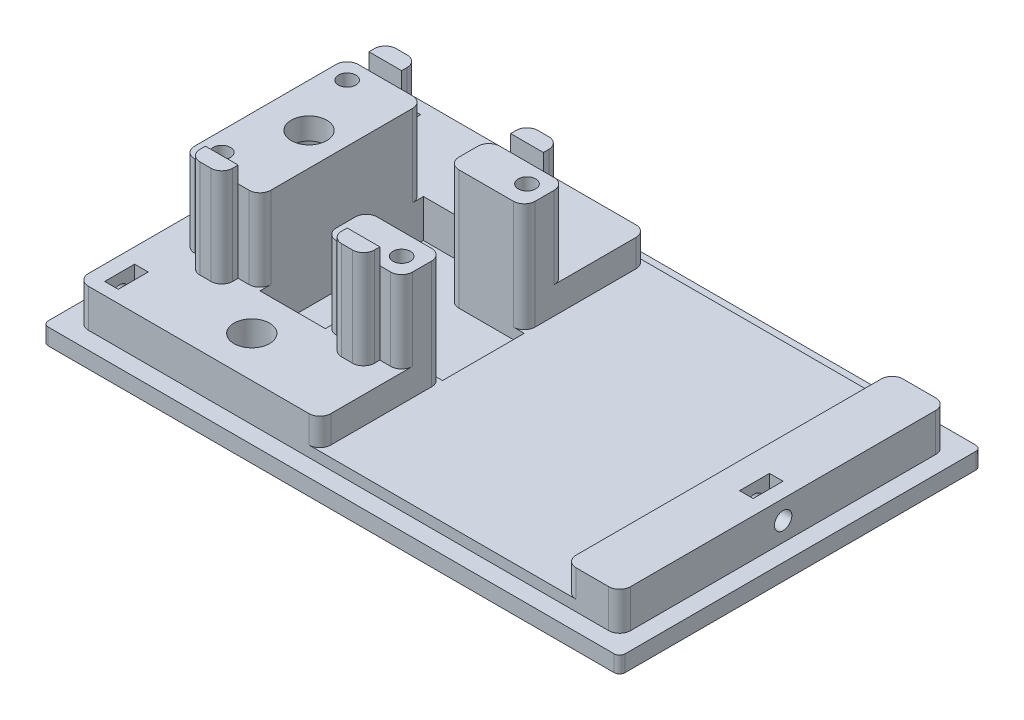
from build123d import *

# Parameters (mm, degrees)
SKETCH1_W                = 40
SKETCH1_H                = 30
BOSS_EXTRUDE1_DEPTH      = 15
SKETCH2_W                = 99.5
SKETCH2_H                = 60
BOSS_EXTRUDE2_DEPTH      = 10
M3_CLEARANCE_HOLE1_D     = 3.2
SKETCH7_W                = 105.85
SKETCH7_H                = 66.35
SKETCH7_W_2              = 99.5
SKETCH7_H_2              = 60
BOSS_EXTRUDE3_DEPTH      = 3
CUT_EXTRUDE2_DEPTH       = 1.25
M3_CLEARANCE_HOLE3_D     = 3.2
M3_CLEARANCE_HOLE3_DEPTH = 12
M3_CLEARANCE_HOLE3_TIP   = 0.96137699
F_1_4_CLEARANCE_HOLE3_D  = 6.5278
SKETCH20_R               = 2.8
SKETCH20_R_2             = 5
CUT_EXTRUDE4_DEPTH       = 21
SKETCH23_W               = 6.48
SKETCH23_H               = 3
BOSS_EXTRUDE5_DEPTH      = 10
SKETCH43_W               = 6
SKETCH43_H               = 3
BOSS_EXTRUDE7_DEPTH      = 18
F_1_4_CLEARANCE_HOLE2_D  = 6.5278
CUT_EXTRUDE9_START       = -22
CUT_EXTRUDE9_DEPTH       = 22
SKETCH45_W               = 45
SKETCH45_H               = 60
CUT_EXTRUDE10_DEPTH      = 5
CUT_EXTRUDE11_DEPTH      = 1.25
M3_CLEARANCE_HOLE5_D     = 3.2
M3_CLEARANCE_HOLE5_DEPTH = 10
M3_CLEARANCE_HOLE5_TIP   = 0.96137699
FILLET3_R                = 2
FILLET4_R                = 1


with BuildPart() as part:
    # Sketch1 → Boss-Extrude1 (new body)
    with BuildSketch(Plane(origin=(0, 0, 0), x_dir=(1, 0, 0), z_dir=(0, 1, 0))):
        Rectangle(SKETCH1_W, SKETCH1_H)
    extrude(amount=-BOSS_EXTRUDE1_DEPTH)

    # Sketch2 → Boss-Extrude2 (add)
    with BuildSketch(Plane.XZ.offset(15)):
        with Locations((25.25, 0)):
            Rectangle(SKETCH2_W, SKETCH2_H)
    extrude(amount=BOSS_EXTRUDE2_DEPTH)

    # M3 Clearance Hole1 (through all)
    with Locations(Plane(origin=(0, 0, 0), x_dir=(1, 0, 0), z_dir=(0, 1, 0))):
        with Locations((-16.5, 11.5), (16.5, 11.5), (-16.5, -11.5), (16.5, -11.5)):
            Hole(M3_CLEARANCE_HOLE1_D / 2)

    # Sketch7 → Boss-Extrude3 (add)
    with BuildSketch(Plane.XZ.offset(25)):
        with Locations((25.25, 0)):
            Rectangle(SKETCH7_W, SKETCH7_H)
        with Locations((25.25, 0)):
            Rectangle(SKETCH7_W_2, SKETCH7_H_2, mode=Mode.SUBTRACT)
    extrude(amount=-BOSS_EXTRUDE3_DEPTH)

    # Sketch14 → Cut-Extrude2 (cut, symmetric)
    with BuildSketch(Plane.ZY.offset(20.5)):
        Polygon((-27.75, -16.91228676), (-27.75, -15), (-22.25, -15), (-22.25, -16.91228676), (-22.25, -20.08771324), (-25, -21.675426481), (-27.75, -20.08771324), align=None)
        Polygon((22.25, -16.91228676), (22.25, -20.08771324), (25, -21.675426481), (27.75, -20.08771324), (27.75, -16.91228676), (27.75, -15), (22.25, -15), align=None)
    extrude(amount=CUT_EXTRUDE2_DEPTH, both=True, mode=Mode.SUBTRACT)

    # M3 Clearance Hole3
    with Locations(Plane.ZY.offset(24.5)):
        with Locations((-25, -18.5), (25, -18.5)):
            Hole(M3_CLEARANCE_HOLE3_D / 2, depth=M3_CLEARANCE_HOLE3_DEPTH)
            with Locations((0, 0, -(M3_CLEARANCE_HOLE3_DEPTH + M3_CLEARANCE_HOLE3_TIP / 2))):  # 118° drill point
                Cone(0, M3_CLEARANCE_HOLE3_D / 2, M3_CLEARANCE_HOLE3_TIP, mode=Mode.SUBTRACT)

    # 1/4 Clearance Hole3 (through all)
    with Locations(Plane(origin=(0, 0, 0), x_dir=(1, 0, 0), z_dir=(0, 1, 0))):
        with Locations((-12, 0)):
            Hole(F_1_4_CLEARANCE_HOLE3_D / 2)

    # Sketch20 → Cut-Extrude4 (cut)
    with BuildSketch(Plane.XZ.offset(25)):
        with Locations(Location((-16.5, 11.5, 0), (0, 0, 270))):
            Circle(SKETCH20_R)
        with Locations(Location((16.5, 11.5, 0), (0, 0, 270))):
            Circle(SKETCH20_R)
        with Locations(Location((16.5, -11.5, 0), (0, 0, 270))):
            Circle(SKETCH20_R)
        with Locations(Location((-16.5, -11.5, 0), (0, 0, 270))):
            Circle(SKETCH20_R)
        with Locations(Location((-12, 0, 0), (0, 0, 270))):
            Circle(SKETCH20_R_2)
    extrude(amount=-CUT_EXTRUDE4_DEPTH, mode=Mode.SUBTRACT)

    # Sketch23 → Boss-Extrude5 (add, symmetric)
    with BuildSketch(Plane.XY):
        with Locations((0, -26.5)):
            Rectangle(SKETCH23_W, SKETCH23_H)
    extrude(amount=BOSS_EXTRUDE5_DEPTH, both=True)

    # Sketch43 → Boss-Extrude7 (add)
    with BuildSketch(Plane(origin=(0, -15, 0), x_dir=(1, 0, 0), z_dir=(0, 1, 0))):
        with Locations((-13, 16.5)):
            Rectangle(SKETCH43_W, SKETCH43_H)
        with Locations((-13, -16.5)):
            Rectangle(SKETCH43_W, SKETCH43_H)
        with Locations((13, 16.5)):
            Rectangle(SKETCH43_W, SKETCH43_H)
        with Locations((13, -16.5)):
            Rectangle(SKETCH43_W, SKETCH43_H)
    extrude(amount=BOSS_EXTRUDE7_DEPTH)

    # 1/4 Clearance Hole2 (through all)
    with Locations(Plane(origin=(0, -15, 0), x_dir=(1, 0, 0), z_dir=(0, 1, 0))):
        with Locations((0, 22.5), (0, -22.5)):
            Hole(F_1_4_CLEARANCE_HOLE2_D / 2)

    # Sketch44 → Cut-Extrude9 (cut)
    with BuildSketch(Plane(origin=(0, 0, 0), x_dir=(1, 0, 0), z_dir=(0, 1, 0)).offset(CUT_EXTRUDE9_START)):
        Polygon((-6, 15), (6, 15), (6, 7.5), (20, 7.5), (20, -7.5), (6, -7.5), (6, -15), (-6, -15), align=None)
    extrude(amount=CUT_EXTRUDE9_DEPTH, mode=Mode.SUBTRACT)

    # Sketch45 → Cut-Extrude10 (cut)
    with BuildSketch(Plane(origin=(0, -15, 0), x_dir=(1, 0, 0), z_dir=(0, 1, 0))):
        with Locations((42.5, 0)):
            Rectangle(SKETCH45_W, SKETCH45_H)
    extrude(amount=-CUT_EXTRUDE10_DEPTH, mode=Mode.SUBTRACT)

    # Sketch46 → Cut-Extrude11 (cut, symmetric)
    with BuildSketch(Plane(origin=(71, 0, 0), x_dir=(0, 0, -1), z_dir=(1, 0, 0))):
        Polygon((-2.75, -16.91228676), (-2.75, -15), (2.75, -15), (2.75, -16.91228676), (2.75, -20.08771324), (0, -21.675426481), (-2.75, -20.08771324), align=None)
    extrude(amount=CUT_EXTRUDE11_DEPTH, both=True, mode=Mode.SUBTRACT)

    # M3 Clearance Hole5
    with Locations(Plane(origin=(75, 0, 0), x_dir=(0, 0, -1), z_dir=(1, 0, 0))):
        with Locations((0, -18.5)):
            Hole(M3_CLEARANCE_HOLE5_D / 2, depth=M3_CLEARANCE_HOLE5_DEPTH)
            with Locations((0, 0, -(M3_CLEARANCE_HOLE5_DEPTH + M3_CLEARANCE_HOLE5_TIP / 2))):  # 118° drill point
                Cone(0, M3_CLEARANCE_HOLE5_D / 2, M3_CLEARANCE_HOLE5_TIP, mode=Mode.SUBTRACT)

    # Fillet3
    fillet3_edges = [part.edges().sort_by_distance(p)[0] for p in [
        (-10, -6, -18),
        (-16, -6, -18),
        (-10, -6, 18),
        (-16, -6, 18),
        (10, -6, 18),
        (16, -6, 18),
        (10, -6, -18),
        (16, -6, -18),
        (6, -7.5, 15),
        (6, -11, 7.5),
        (20, -10, 7.5),
        (20, -10, -7.5),
        (6, -11, -7.5),
        (6, -7.5, -15),
        (-6, -7.5, -15),
        (-6, -7.5, 15),
        (20, -17.5, 30),
        (65, -17.5, 30),
        (65, -17.5, -30),
        (20, -17.5, -30),
        (-24.5, -18.5, 30),
        (75, -18.5, 30),
        (75, -18.5, -30),
        (-24.5, -18.5, -30),
        (20, -7.5, 15),
        (-20, -7.5, 15),
        (-20, -7.5, -15),
        (20, -7.5, -15),
    ]]
    fillet(fillet3_edges, radius=FILLET3_R)

    # Fillet4
    fillet4_edges = [part.edges().sort_by_distance(p)[0] for p in [
        (-27.675, -23.5, 33.175),
        (78.175, -23.5, 33.175),
        (78.175, -23.5, -33.175),
        (-27.675, -23.5, -33.175),
    ]]
    fillet(fillet4_edges, radius=FILLET4_R)


solid = part.part
